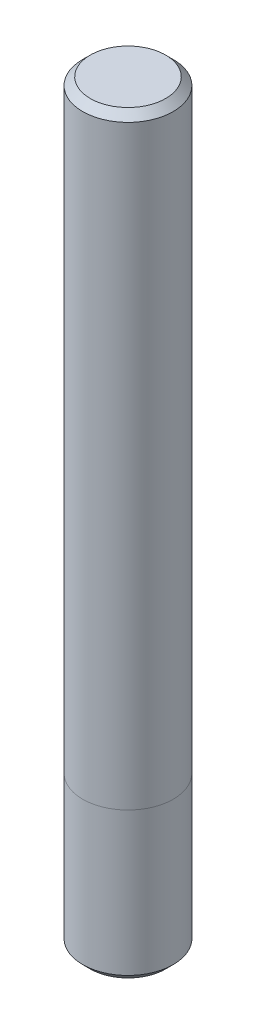
from build123d import *

# Parameters (mm, degrees)
SKETCH1_R           = 1.5
BOSS_EXTRUDE1_DEPTH = 12.5
CHAMFER1_SIZE       = 0.25


with BuildPart() as part:
    # Sketch1 → Boss-Extrude1 (new, symmetric)
    with BuildSketch(Plane(origin=(0, 0, 0), x_dir=(1, 0, 0), z_dir=(0, 1, 0))):
        with Locations(Location((0, 0, 0), (0, 0, 270))):
            Circle(SKETCH1_R)
    extrude(amount=BOSS_EXTRUDE1_DEPTH, both=True)

    # Chamfer1
    chamfer1_edges = [part.edges().sort_by_distance(p)[0] for p in [
        (0, -12.5, -1.5),
        (0, 12.5, -1.5),
    ]]
    chamfer(chamfer1_edges, length=CHAMFER1_SIZE)


solid = part.part
